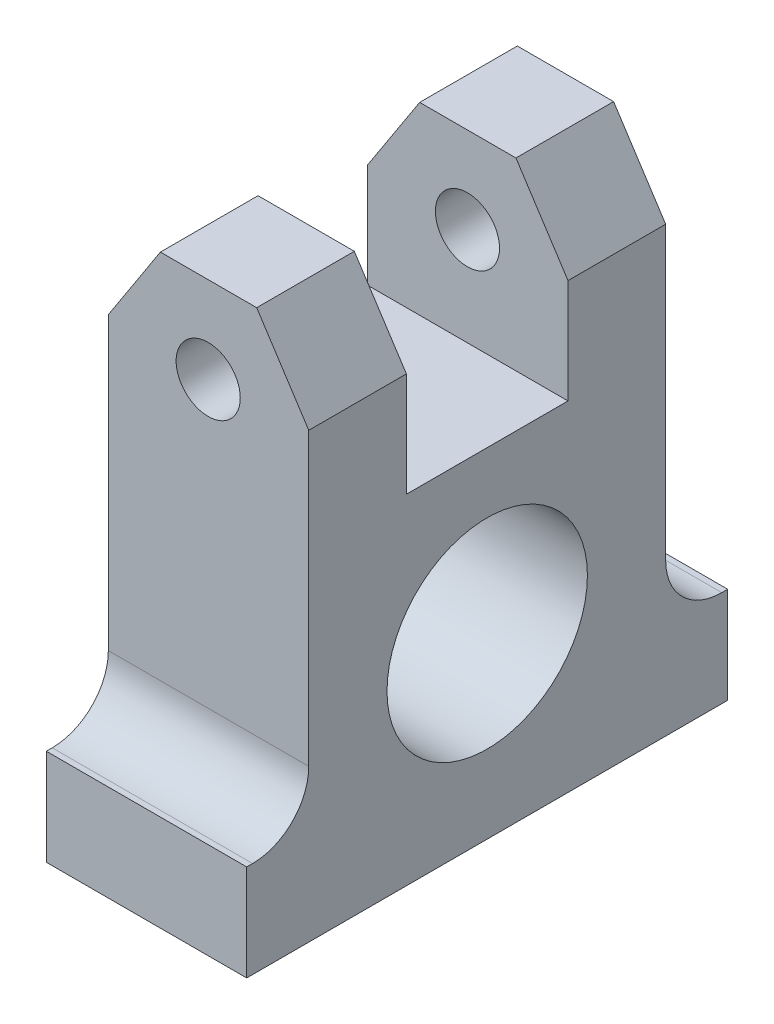
from build123d import *
from OCP.BRepFilletAPI import BRepFilletAPI_MakeChamfer

# Parameters (mm, degrees)
SKETCH_1_W          = 44.524667954
SKETCH_1_H          = 33.301696974
EXTRUDE_1_DEPTH     = 25
SKETCH_2_W          = 25
SKETCH_2_H          = 44.524667954
EXTRUDE_2_DEPTH     = 20
SKETCH_3_R          = 4
CUT_EXTRUDE_1_DEPTH = 67.802936569
SKETCH_4_W          = 57.585084074
SKETCH_4_H          = 20.16053609
CUT_EXTRUDE_2_DEPTH = 23
CHAMFER_2_SIZE      = 10
CHAMFER_2_SIZE2     = 6.494075932
SKETCH_5_W          = 25
SKETCH_5_H          = 60
EXTRUDE_3_DEPTH     = 12
FILLET_2_R          = 7
SKETCH_6_R          = 12.5
CUT_EXTRUDE_3_DEPTH = 59.13936943


with BuildPart() as part:
    # Эскиз1 → Вытянуть1 (new body)
    with BuildSketch(Plane(origin=(0, 0, 0), x_dir=(0, 0, -1), z_dir=(1, 0, 0))):
        with Locations((0, 6.421024908)):
            Rectangle(SKETCH_1_W, SKETCH_1_H)
    extrude(amount=EXTRUDE_1_DEPTH)

    # Эскиз2 → Вытянуть2 (add)
    with BuildSketch(Plane(origin=(0, 23.071873395, 0), x_dir=(1, 0, 0), z_dir=(0, 1, 0))):
        with Locations((12.5, 0)):
            Rectangle(SKETCH_2_W, SKETCH_2_H)
    extrude(amount=EXTRUDE_2_DEPTH)

    # Эскиз3 → Вырез-Вытянуть1 (cut, through all)
    with BuildSketch(Plane.XY.offset(22.262333977)):
        with Locations((12.457612309, 32.292854615)):
            Circle(SKETCH_3_R)
    extrude(amount=-CUT_EXTRUDE_1_DEPTH, mode=Mode.SUBTRACT)

    # Эскиз4 → Вырез-Вытянуть2 (cut)
    with BuildSketch(Plane(origin=(0, 43.071873395, 0), x_dir=(1, 0, 0), z_dir=(0, 1, 0))):
        Rectangle(SKETCH_4_W, SKETCH_4_H)
    extrude(amount=-CUT_EXTRUDE_2_DEPTH, mode=Mode.SUBTRACT)

    # Фаска2: one chamfer whose edges measure the first distance from different faces: ONE call of the kernel's chamfer builder (chamfer() names one face for all edges)
    chamfer_2_edges_1 = [part.edges().sort_by_distance(p)[0] for p in [
        (0, 43.071873395, -16.171301011),
        (0, 43.071873395, 16.171301011),
    ]]
    chamfer_2_side_1 = [part.faces().sort_by_distance(p)[0] for p in [
        (0, 12.741969901, 0),
    ]]
    chamfer_2_edges_2 = [part.edges().sort_by_distance(p)[0] for p in [
        (25, 43.071873395, 16.171301011),
        (25, 43.071873395, -16.171301011),
    ]]
    chamfer_2_side_2 = [part.faces().sort_by_distance(p)[0] for p in [
        (25, 12.741969901, 0),
    ]]
    chamfer_2 = BRepFilletAPI_MakeChamfer(part.part.solid().wrapped)
    for e in chamfer_2_edges_1:
        chamfer_2.Add(CHAMFER_2_SIZE, CHAMFER_2_SIZE2, e.wrapped, chamfer_2_side_1[0].wrapped)  # the first distance lies on this face
    for e in chamfer_2_edges_2:
        chamfer_2.Add(CHAMFER_2_SIZE, CHAMFER_2_SIZE2, e.wrapped, chamfer_2_side_2[0].wrapped)  # the first distance lies on this face
    add(Compound.cast(chamfer_2.Shape()), mode=Mode.REPLACE)

    # Эскиз5 → Вытянуть3 (add)
    with BuildSketch(Plane.XZ.offset(10.229823579)):
        with Locations((12.5, 0)):
            Rectangle(SKETCH_5_W, SKETCH_5_H)
    extrude(amount=EXTRUDE_3_DEPTH)

    # Скругление2
    fillet_2_edges = [part.edges().sort_by_distance(p)[0] for p in [
        (12.5, -10.229823579, -22.262333977),
        (12.5, -10.229823579, 22.262333977),
    ]]
    fillet(fillet_2_edges, radius=FILLET_2_R)

    # Эскиз6 → Вырез-Вытянуть3 (cut, through all)
    with BuildSketch(Plane(origin=(25, 0, 0), x_dir=(0, 0, -1), z_dir=(1, 0, 0))):
        with Locations((1.8e-08, 3.6e-08)):
            Circle(SKETCH_6_R)
    extrude(amount=-CUT_EXTRUDE_3_DEPTH, mode=Mode.SUBTRACT)


solid = part.part
